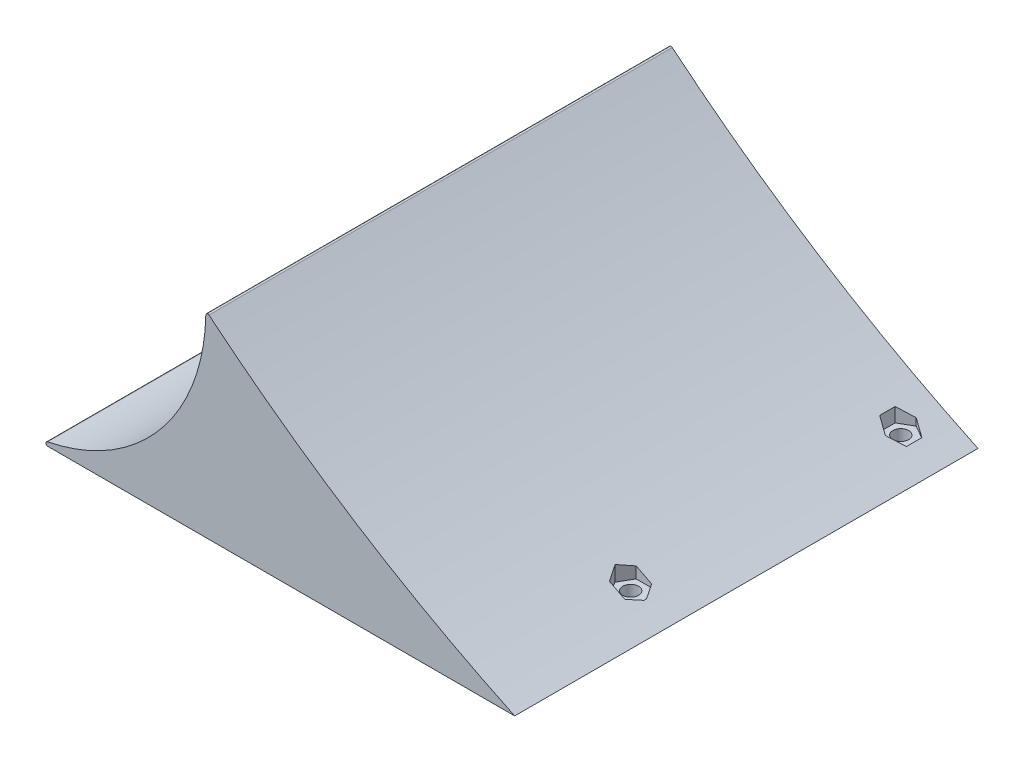
from build123d import *

# Parameters (mm, degrees)
EXTRUDE_1_DEPTH     = 120
FILLET_1_R          = 0.5
CUT_EXTRUDE_1_DEPTH = 48
SKETCH_5_R          = 2.0500000000000123
SKETCH_5_R_2        = 2.0500000000000056
SKETCH_5_R_3        = 2.0499999999999923
CUT_EXTRUDE_2_DEPTH = 5
SKETCH_6_R          = 70.99685128536404
CUT_EXTRUDE_3_DEPTH = 185.82965146426048


with BuildPart() as part:
    # 草图3 → 凸台-拉伸1 (new, symmetric)
    with BuildSketch(Plane.XY):
        with BuildLine():
            Line((131, -50.99999999999999), (6.25e-15, -51))
            ThreePointArc((6.25e-15, -51), (36.062445840513924, -36.062445840513924), (51, 0))
            ThreePointArc((51, 0), (89.3844868048509, -28.034138345331712), (131, -50.99999999999999))
        make_face()
    extrude(amount=EXTRUDE_1_DEPTH, both=True)

    # 圆角1
    fillet_1_edges = [part.edges().sort_by_distance(p)[0] for p in [
        (50.99999999999999, -2.664e-14, 0),
        (6.25e-15, -51, 0),
    ]]
    fillet(fillet_1_edges, radius=FILLET_1_R)

    # 草图4 → 切除-拉伸1 (cut)
    with BuildSketch(Plane(origin=(0, 0, 0), x_dir=(1, 0, 0), z_dir=(0, 1, 0))):
        Polygon((124.4641016151378, -112), (124.4641016151378, -108), (121.00000000000006, -106.00000000000001), (117.5358983848623, -108), (117.5358983848623, -112), (121.00000000000004, -113.99999999999999), align=None)
        Polygon((29.599504938362088, -106.00000000000001), (26.135403323224345, -108.00000000000001), (26.135403323224345, -112), (29.599504938362088, -113.99999999999999), (33.06360655349983, -112), (33.06360655349983, -108.00000000000001), align=None)
        Polygon((33.06360655349983, 108.00000000000001), (29.599504938362088, 106.00000000000001), (26.135403323224345, 108.00000000000001), (26.135403323224345, 112), (29.599504938362088, 113.99999999999999), (33.06360655349983, 112), align=None)
        Polygon((121.00000000000004, 113.99999999999999), (124.4641016151378, 112), (124.4641016151378, 108), (121.00000000000006, 106.00000000000001), (117.5358983848623, 108), (117.5358983848623, 112), align=None)
        Polygon((123.00000000000004, -36.53589838486225), (119.00000000000006, -36.53589838486225), (117.00000000000004, -39.99999999999999), (119.00000000000004, -43.46410161513774), (123.00000000000003, -43.46410161513774), (125.00000000000006, -39.99999999999999), align=None)
        Polygon((125.00000000000003, 40.00000000000008), (123.00000000000001, 43.464101615137785), (119.00000000000001, 43.464101615137785), (116.99999999999999, 40), (118.99999999999997, 36.535898384862286), (123.00000000000006, 36.535898384862286), align=None)
    extrude(amount=-CUT_EXTRUDE_1_DEPTH, mode=Mode.SUBTRACT)

    # 草图5 → 切除-拉伸2 (cut)
    with BuildSketch(Plane(origin=(2.54e-15, -47.99999999999999, 0), x_dir=(1, 5e-17, 0), z_dir=(-5e-17, 1, 0))):
        with Locations(Location((29.599504938362074, -110.00000000000001, 0), (0, 0, 180))):
            Circle(SKETCH_5_R)
        with Locations((29.599504938362074, 110.00000000000001)):
            Circle(SKETCH_5_R)
        with Locations(Location((121, 110.00000000000001, 0), (0, 0, 180))):
            Circle(SKETCH_5_R_2)
        with Locations((121.00000000000006, -110)):
            Circle(SKETCH_5_R_2)
        with Locations(Location((120.94806034143625, 40.089962127560234, 0), (0, 0, 180))):
            Circle(SKETCH_5_R_3)
        with Locations(Location((121.00000000000006, -40, 0), (0, 0, 180))):
            Circle(SKETCH_5_R_3)
    extrude(amount=-CUT_EXTRUDE_2_DEPTH, mode=Mode.SUBTRACT)

    # 草图6 → 切除-拉伸3 (cut, through all)
    with BuildSketch(Plane.XY):
        with Locations((70.54975246918104, -50.99999999999999)):
            Circle(SKETCH_6_R)
    extrude(amount=CUT_EXTRUDE_3_DEPTH, mode=Mode.SUBTRACT)


solid = part.part
